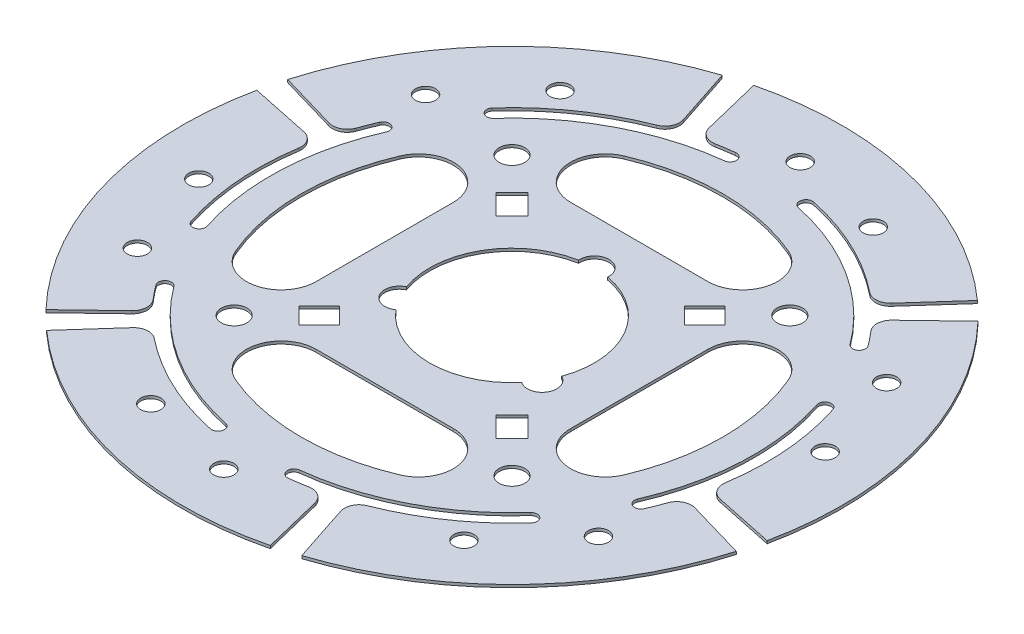
from build123d import *

# Parameters (mm, degrees)
SKETCH2_R                = 90
BOSS_EXTRUDE1_DEPTH      = 0.75
CUT_EXTRUDE1_DEPTH       = 0.75
CUT_EXTRUDE2_START       = -0.75
CUT_EXTRUDE2_DEPTH       = 129.031430303
CUT_EXTRUDE3_DEPTH       = 0.75
CIRPATTERN1_COUNT        = 4
FILLET1_R                = 4
CIRPATTERN3_COUNT        = 6
FILLET1_OF_CIRPATTERN3_R = 4
SKETCH8_R                = 2.75
CUT_EXTRUDE6_DEPTH       = 10
CIRPATTERN5_COUNT        = 6
SKETCH10_R               = 3.5
CUT_EXTRUDE8_DEPTH       = 128.281430303
CIRPATTERN6_COUNT        = 4


with BuildPart() as part:
    # Sketch2 → Boss-Extrude1 (new body)
    with BuildSketch(Plane(origin=(0, 0, 0), x_dir=(1, 0, 0), z_dir=(0, 1, 0))):
        with Locations(Location((0, 0, 0), (0, 0, 270))):
            Circle(SKETCH2_R)
        with BuildLine():
            ThreePointArc((-17.185568345, -14.522611358), (-22.9496732, -13.25), (-21.169734538, -7.621833087))
            ThreePointArc((-21.169734538, -7.621833087), (-19.485571585, 11.25), (-3.984166192, 22.144444444))
            ThreePointArc((-3.984166192, 22.144444444), (-0.177953971, 26.496039587), (4, 22.5))
            ThreePointArc((4, 22.5), (3.996039587, 22.322046029), (3.984166192, 22.144444444))
            ThreePointArc((3.984166192, 22.144444444), (17.261137554, 14.432710429), (22.5, 0))
            ThreePointArc((22.5, 0), (22.164938835, -3.8685251), (21.169734538, -7.621833087))
            ThreePointArc((21.169734538, -7.621833087), (22.857266397, -9.097867547), (23.485571585, -11.25))
            ThreePointArc((23.485571585, -11.25), (21.32947872, -14.799648783), (17.185568345, -14.522611358))
            ThreePointArc((17.185568345, -14.522611358), (0, -22.5), (-17.185568345, -14.522611358))
        make_face(mode=Mode.SUBTRACT)
    extrude(amount=BOSS_EXTRUDE1_DEPTH)

    # Sketch3 → Cut-Extrude1 (cut)
    with BuildSketch(Plane(origin=(0, 0.75, 0), x_dir=(1, 0, 0), z_dir=(0, 1, 0))):
        with BuildLine():
            Line((18.75, 34.75), (-18.75, 34.75))
            ThreePointArc((-18.75, 34.75), (-28.059393859, 42.356541264), (-22.4609375, 52.995224003))
            ThreePointArc((-22.4609375, 52.995224003), (0, 57.563605035), (22.4609375, 52.995224003))
            ThreePointArc((22.4609375, 52.995224003), (28.059393859, 42.356541264), (18.75, 34.75))
        make_face()
    cut_extrude1 = extrude(amount=-CUT_EXTRUDE1_DEPTH, mode=Mode.SUBTRACT)

    # Sketch4 → Cut-Extrude2 (cut)
    with BuildSketch(Plane(origin=(0, 0.75, 0), x_dir=(1, 0, 0), z_dir=(0, 1, 0)).offset(CUT_EXTRUDE2_START)):
        with BuildLine():
            Line((50.194444444, 48.07044567), (65, 62.24949799))
            ThreePointArc((65, 62.24949799), (62.546689472, 64.714076027), (60, 67.082039325))
            Line((60, 67.082039325), (46.326130039, 51.8086834))
            ThreePointArc((46.326130039, 51.8086834), (31.405257095, 61.999676022), (14.361623616, 67.99995417))
            ThreePointArc((14.361623616, 67.99995417), (12.287770938, 66.649348724), (13.638376384, 64.575496046))
            ThreePointArc((13.638376384, 64.575496046), (35.62942383, 55.556675185), (52.99956323, 39.332509421))
            ThreePointArc((52.99956323, 39.332509421), (55.447762126, 38.970125419), (55.810146129, 41.418324315))
            ThreePointArc((55.810146129, 41.418324315), (53.106553129, 44.832399163), (50.194444444, 48.07044567))
        make_face()
    cut_extrude2 = extrude(amount=CUT_EXTRUDE2_DEPTH, mode=Mode.SUBTRACT)

    # Sketch5 → Cut-Extrude3 (cut)
    with BuildSketch(Plane(origin=(0, 0.75, 0), x_dir=(1, 0, 0), z_dir=(0, 1, 0))):
        Polygon((-21.336947122, 25.756364505), (-26.852380016, 31.271797398), (-31.271797398, 26.852380016), (-25.756364505, 21.336947122), align=None)
    cut_extrude3 = extrude(amount=-CUT_EXTRUDE3_DEPTH, mode=Mode.SUBTRACT)

    # CirPattern1: Cut-Extrude1, Cut-Extrude3 ×4 about axis
    cirpattern1_axis = Axis((0, 0, 0), (0, 1, 0))
    add([cut_extrude1.rotate(cirpattern1_axis, i * 360 / CIRPATTERN1_COUNT) for i in range(1, CIRPATTERN1_COUNT)], mode=Mode.SUBTRACT)
    add([cut_extrude3.rotate(cirpattern1_axis, i * 360 / CIRPATTERN1_COUNT) for i in range(1, CIRPATTERN1_COUNT)], mode=Mode.SUBTRACT)

    # Fillet1
    fillet1_edges = [part.edges().sort_by_distance(p)[0] for p in [
        (46.326130039, 0.375, -51.8086834),
        (50.194444444, 0.375, -48.07044567),
    ]]
    fillet(fillet1_edges, radius=FILLET1_R)

    # CirPattern3: Cut-Extrude2 ×6 about axis
    cirpattern3_axis = Axis((0, 0, 0), (0, 1, 0))
    for i in range(1, CIRPATTERN3_COUNT):
        add(cut_extrude2.rotate(cirpattern3_axis, i * 360 / CIRPATTERN3_COUNT), mode=Mode.SUBTRACT)

    # Fillet1 of CirPattern3
    fillet1_of_cirpattern3_edges = [part.edges().sort_by_distance(p)[0] for p in [
        (-21.704570942, 0.375, -66.023947172),
        (-16.533004899, 0.375, -67.504886853),
        (-68.03070098, 0.375, -14.215263772),
        (-66.727449344, 0.375, -19.434441183),
        (-46.326130039, 0.375, 51.8086834),
        (-50.194444444, 0.375, 48.07044567),
        (21.704570942, 0.375, 66.023947172),
        (16.533004899, 0.375, 67.504886853),
        (68.03070098, 0.375, 14.215263772),
        (66.727449344, 0.375, 19.434441183),
    ]]
    fillet(fillet1_of_cirpattern3_edges, radius=FILLET1_OF_CIRPATTERN3_R)

    # Sketch8 → Cut-Extrude6 (cut)
    with BuildSketch(Plane.XZ):
        with Locations(Location((-3, 75.690570747, 0), (0, 0, 270))):
            Circle(SKETCH8_R)
        with Locations(Location((-28.417446421, 70.217599211, 0), (0, 0, 270))):
            Circle(SKETCH8_R)
    cut_extrude6 = extrude(amount=-CUT_EXTRUDE6_DEPTH, mode=Mode.SUBTRACT)

    # CirPattern5: Cut-Extrude6 ×6 about axis
    cirpattern5_axis = Axis((0, 0, 0), (0, 1, 0))
    for i in range(1, CIRPATTERN5_COUNT):
        add(cut_extrude6.rotate(cirpattern5_axis, i * 360 / CIRPATTERN5_COUNT), mode=Mode.SUBTRACT)

    # Sketch10 → Cut-Extrude8 (cut, through all)
    with BuildSketch(Plane(origin=(0, 0.75, 0), x_dir=(1, 0, 0), z_dir=(0, 1, 0))):
        with Locations(Location((37.936278811, 37.936278811, 0), (0, 0, 270))):
            Circle(SKETCH10_R)
    cut_extrude8 = extrude(amount=-CUT_EXTRUDE8_DEPTH, mode=Mode.SUBTRACT)

    # CirPattern6: Cut-Extrude8 ×4 about axis
    cirpattern6_axis = Axis((0, 0, 0), (0, 1, 0))
    for i in range(1, CIRPATTERN6_COUNT):
        add(cut_extrude8.rotate(cirpattern6_axis, i * 360 / CIRPATTERN6_COUNT), mode=Mode.SUBTRACT)


solid = part.part
